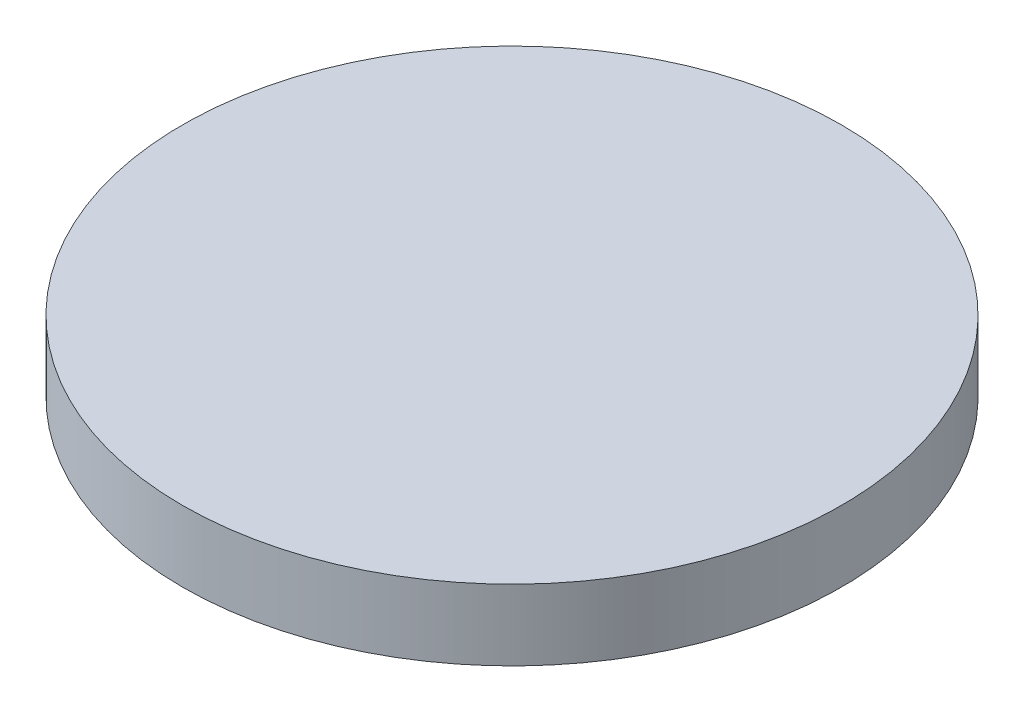
from build123d import *

# Parameters (mm, degrees)
SKETCH1_R           = 18.62
BOSS_EXTRUDE1_DEPTH = 4


with BuildPart() as part:
    # Sketch1 → Boss-Extrude1 (new body)
    with BuildSketch(Plane(origin=(0, 0, 0), x_dir=(1, 0, 0), z_dir=(0, 1, 0))):
        with Locations(Location((0, 0, 0), (0, 0, 270))):
            Circle(SKETCH1_R)
    extrude(amount=BOSS_EXTRUDE1_DEPTH)


solid = part.part
